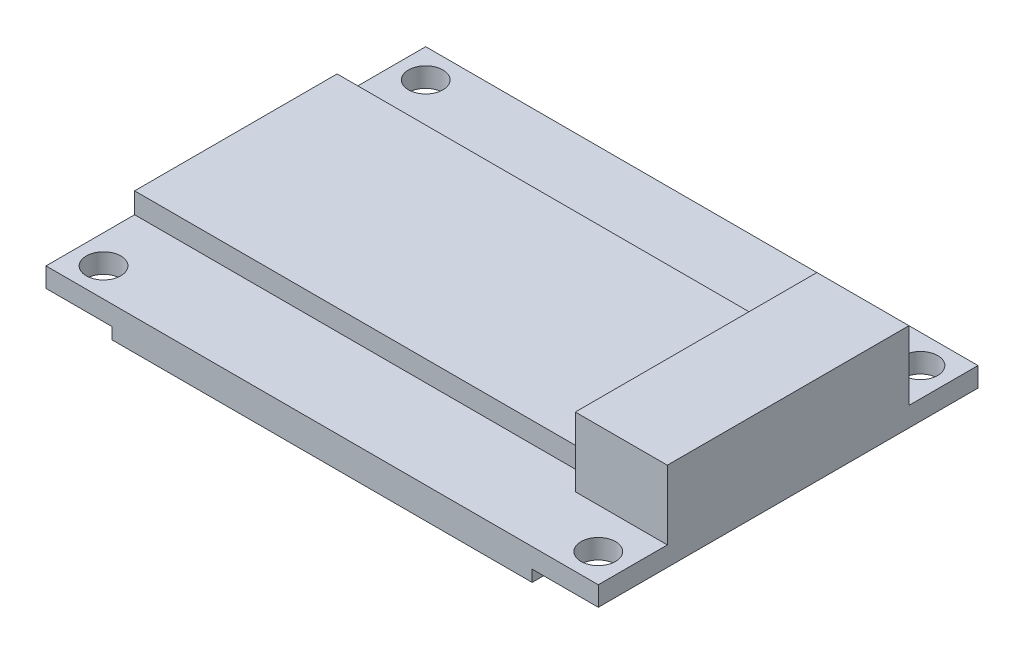
from build123d import *

# Parameters (mm, degrees)
SKETCH1_W           = 48
SKETCH1_H           = 33
BOSS_EXTRUDE1_DEPTH = 1.7
SKETCH2_W           = 8
SKETCH2_H           = 21
BOSS_EXTRUDE2_DEPTH = 6
SKETCH3_R           = 1.5
CUT_EXTRUDE1_DEPTH  = 59.557663888
SKETCH4_W           = 36.5
SKETCH4_H           = 33
BOSS_EXTRUDE3_DEPTH = 1
SKETCH6_W           = 40
SKETCH6_H           = 17.6
BOSS_EXTRUDE4_DEPTH = 1.8


with BuildPart() as part:
    # Sketch1 → Boss-Extrude1 (new body)
    with BuildSketch(Plane(origin=(0, 0, 0), x_dir=(1, 0, 0), z_dir=(0, 1, 0))):
        with Locations((24, 16.5)):
            Rectangle(SKETCH1_W, SKETCH1_H)
    extrude(amount=BOSS_EXTRUDE1_DEPTH)

    # Sketch2 → Boss-Extrude2 (add)
    with BuildSketch(Plane(origin=(0, 1.7, 0), x_dir=(1, 0, 0), z_dir=(0, 1, 0))):
        with Locations((44, 16.5)):
            Rectangle(SKETCH2_W, SKETCH2_H)
    extrude(amount=BOSS_EXTRUDE2_DEPTH)

    # Sketch3 → Cut-Extrude1 (cut, through all)
    with BuildSketch(Plane(origin=(0, 1.7, 0), x_dir=(1, 0, 0), z_dir=(0, 1, 0))):
        with Locations(Location((2.5, 2.5, 0), (0, 0, 270))):
            Circle(SKETCH3_R)
        with Locations(Location((45.5, 2.5, 0), (0, 0, 90))):
            Circle(SKETCH3_R)
        with Locations(Location((45.5, 30.5, 0), (0, 0, 270))):
            Circle(SKETCH3_R)
        with Locations(Location((2.5, 30.5, 0), (0, 0, 90))):
            Circle(SKETCH3_R)
    extrude(amount=-CUT_EXTRUDE1_DEPTH, mode=Mode.SUBTRACT)

    # Sketch4 → Boss-Extrude3 (add)
    with BuildSketch(Plane(origin=(0, 0, 0), x_dir=(-1, 0, 0), z_dir=(0, -1, 0))):
        with Locations((-24, 16.5)):
            Rectangle(SKETCH4_W, SKETCH4_H)
    extrude(amount=BOSS_EXTRUDE3_DEPTH)

    # Sketch6 → Boss-Extrude4 (add)
    with BuildSketch(Plane(origin=(0, 1.7, 0), x_dir=(1, 0, 0), z_dir=(0, 1, 0))):
        with Locations((20, 16.5)):
            Rectangle(SKETCH6_W, SKETCH6_H)
    extrude(amount=BOSS_EXTRUDE4_DEPTH)


solid = part.part
